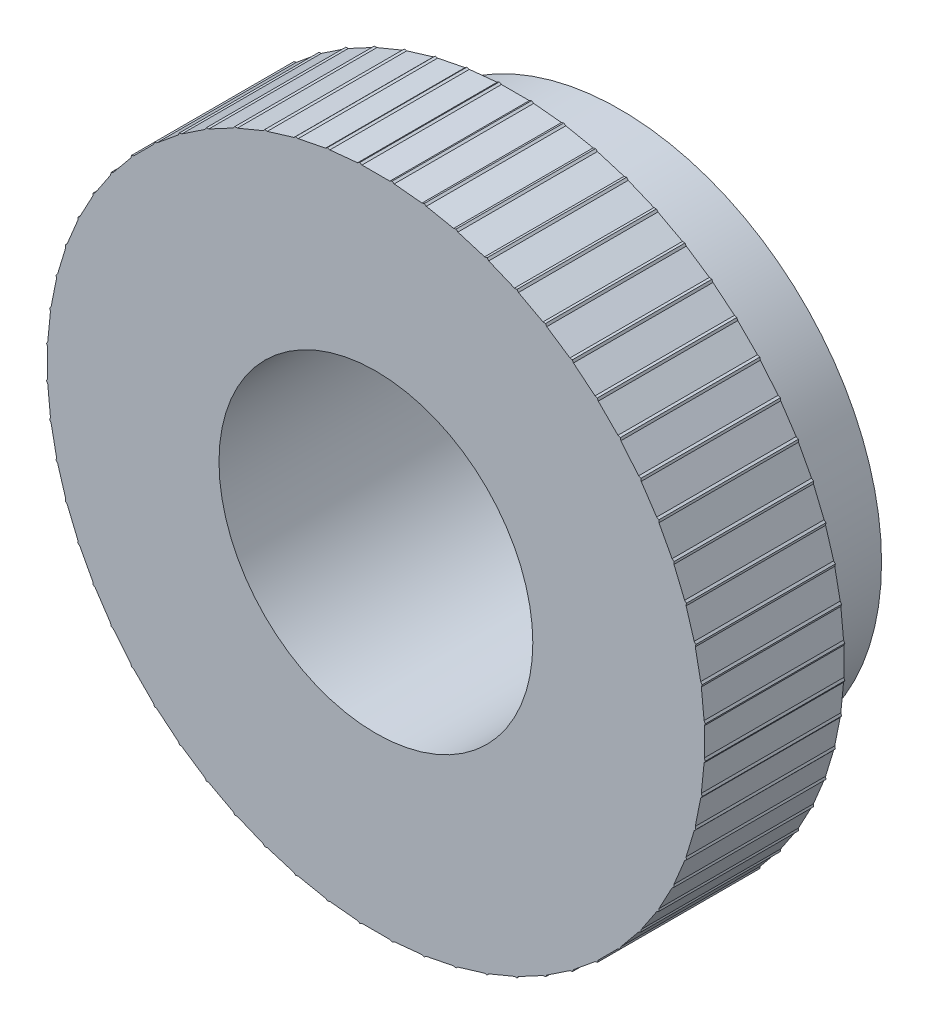
from build123d import *

# Parameters (mm, degrees)
CUT_EXTRUDE1_DEPTH = 51.596491973
CIRPATTERN1_COUNT  = 64


with BuildPart() as part:
    # Sketch2 → Revolve1 (revolve)
    with BuildSketch(Plane(origin=(0, 0, 0), x_dir=(0, 0, -1), z_dir=(1, 0, 0))):
        Polygon((0, 13.5), (0, 32.55), (12, 32.55), (12, 22.5), (21, 22.5), (21, 13.5), align=None)
    revolve(axis=Axis((0, 0, -88.99), (0, 0, 1)))

    # Sketch3 → Cut-Extrude1 (cut, through all)
    with BuildSketch(Plane.XY):
        with BuildLine():
            Line((3.674234614, 31), (3.75, 31))
            Line((3.75, 31), (3.75, 33))
            Line((3.75, 33), (-3.75, 33))
            Line((-3.75, 33), (-3.75, 31))
            Line((-3.75, 31), (-3.674234614, 31))
            ThreePointArc((-3.674234614, 31), (-3.199892965, 30.830947502), (-2.939387691, 30.4))
            ThreePointArc((-2.939387691, 30.4), (-2.331759211, 29.112435701), (-1.198957881, 28.25))
            Line((-1.198957881, 28.25), (1.198957881, 28.25))
            ThreePointArc((1.198957881, 28.25), (2.331759211, 29.112435701), (2.939387691, 30.4))
            ThreePointArc((2.939387691, 30.4), (3.199892965, 30.830947502), (3.674234614, 31))
        make_face()
    cut_extrude1 = extrude(amount=-CUT_EXTRUDE1_DEPTH, mode=Mode.SUBTRACT)

    # CirPattern1: Cut-Extrude1 ×64 about axis
    cirpattern1_axis = Axis((0, 0, -88.99), (0, 0, 1))
    for i in range(1, CIRPATTERN1_COUNT):
        add(cut_extrude1.rotate(cirpattern1_axis, i * 360 / CIRPATTERN1_COUNT), mode=Mode.SUBTRACT)


solid = part.part
